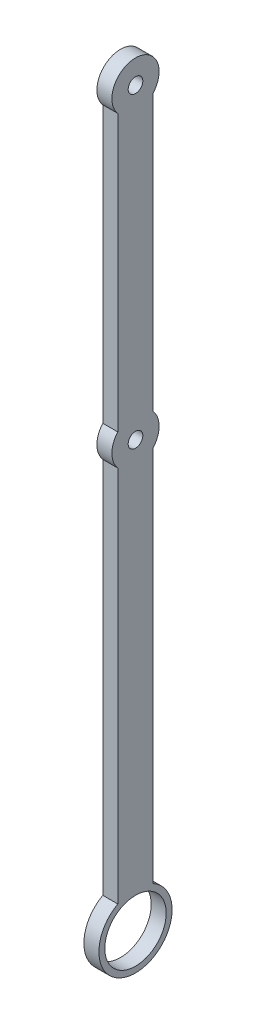
from build123d import *

# Parameters (mm, degrees)
SKETCH1_R           = 1.55
SKETCH1_R_2         = 6.5
BOSS_EXTRUDE3_DEPTH = 3.175


with BuildPart() as part:
    # Sketch1 → Boss-Extrude3 (new body)
    with BuildSketch(Plane(origin=(0, 0, 0), x_dir=(0, 0, -1), z_dir=(1, 0, 0))):
        with BuildLine():
            Line((3.75, -3.307189139), (3.75, -61.692810861))
            ThreePointArc((3.75, -61.692810861), (5, -65), (3.75, -68.307189139))
            Line((3.75, -68.307189139), (3.75, -148.217670017))
            ThreePointArc((3.75, -148.217670017), (0, -162.75), (-3.75, -148.217670017))
            Line((-3.75, -148.217670017), (-3.75, -68.307189139))
            ThreePointArc((-3.75, -68.307189139), (-5, -65), (-3.75, -61.692810861))
            Line((-3.75, -61.692810861), (-3.75, -3.307189139))
            ThreePointArc((-3.75, -3.307189139), (0, 5), (3.75, -3.307189139))
        make_face()
        Circle(SKETCH1_R, mode=Mode.SUBTRACT)
        with Locations((0, -65)):
            Circle(SKETCH1_R, mode=Mode.SUBTRACT)
        with Locations((0, -155)):
            Circle(SKETCH1_R_2, mode=Mode.SUBTRACT)
    extrude(amount=BOSS_EXTRUDE3_DEPTH)


solid = part.part
